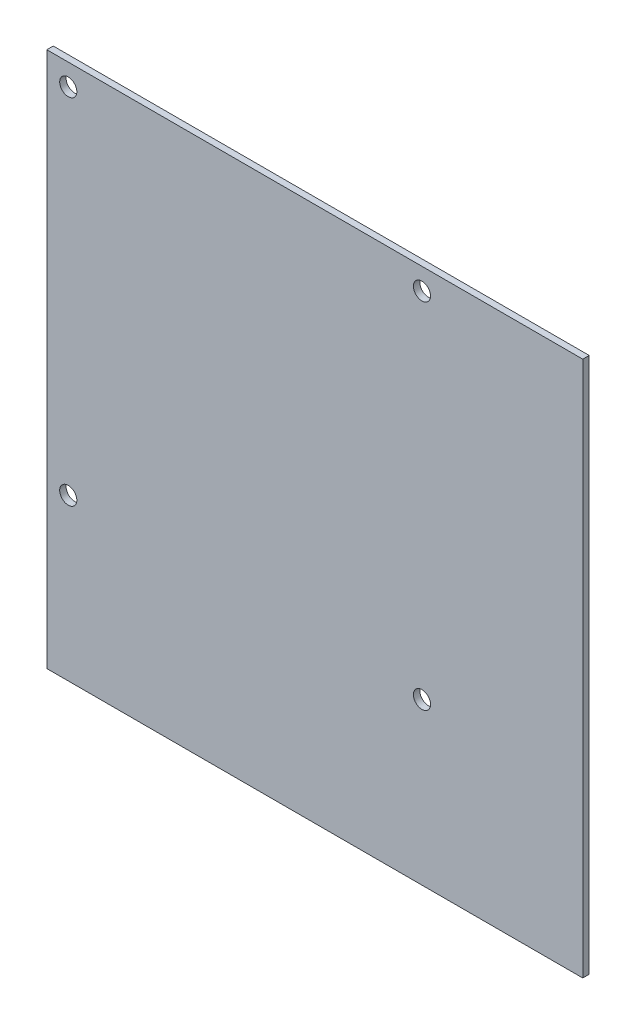
from build123d import *

# Parameters (mm, degrees)
SKETCH_1_W          = 250
SKETCH_1_H          = 250
EXTRUDE_1_DEPTH     = 3
SKETCH_2_R          = 4
CUT_EXTRUDE_1_DEPTH = 3


with BuildPart() as part:
    # ｽｹｯﾁ1 → ﾎﾞｽ - 押し出し1 (new body)
    with BuildSketch(Plane.XY):
        Rectangle(SKETCH_1_W, SKETCH_1_H)
    extrude(amount=EXTRUDE_1_DEPTH)

    # ｽｹｯﾁ2 → ｶｯﾄ - 押し出し1 (cut)
    with BuildSketch(Plane.XY.offset(3)):
        with Locations((-115, 115)):
            Circle(SKETCH_2_R)
        with Locations((50, 115)):
            Circle(SKETCH_2_R)
        with Locations((-115, -50)):
            Circle(SKETCH_2_R)
        with Locations((50, -50)):
            Circle(SKETCH_2_R)
    extrude(amount=-CUT_EXTRUDE_1_DEPTH, mode=Mode.SUBTRACT)


solid = part.part
